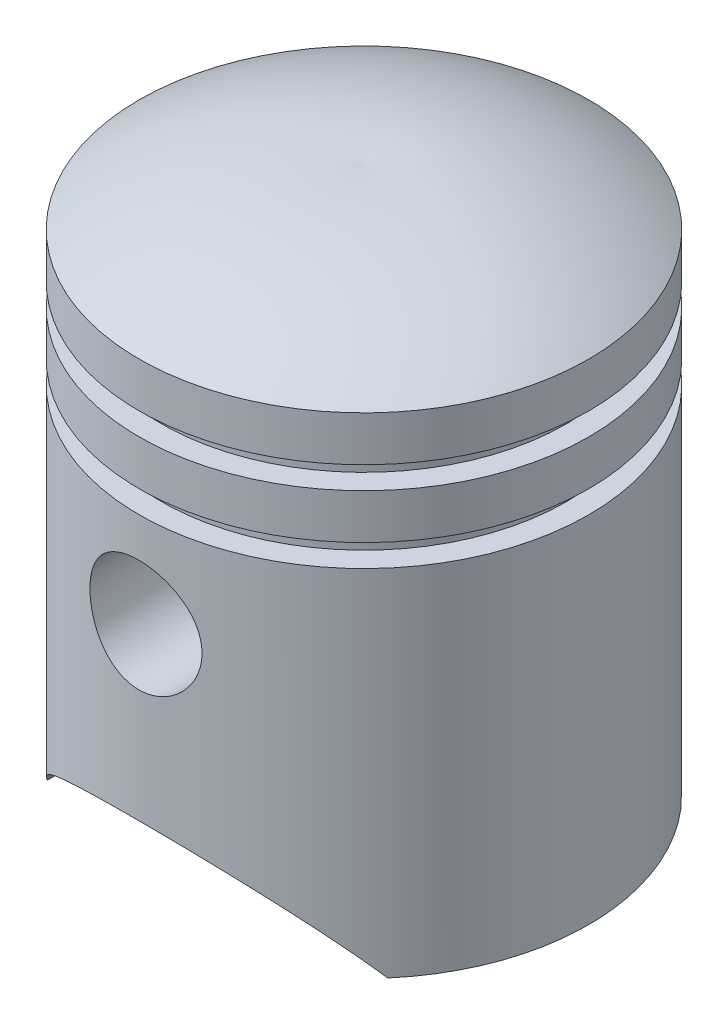
from build123d import *

# Parameters (mm, degrees)
SKETCH4_R                = 6.25
CUT_EXTRUDE3_DEPTH       = 32
BOSS_EXTRUDE7_REACH      = 84.511
BOSS_EXTRUDE7_END_RADIUS = 23
BOSS_EXTRUDE7_START      = 12
SKETCH9_R                = 7.25
SKETCH9_R_2              = 6.25


with BuildPart() as part:
    # Sketch1 → Revolve4 (revolve)
    with BuildSketch(Plane.XY, mode=Mode.PRIVATE) as revolve4_sk:
        with BuildLine():
            Line((25.048630769, 0), (25.048630769, 39.5))
            Line((25.048630769, 39.5), (22.548630769, 39.5))
            Line((22.548630769, 39.5), (22.548630769, 42))
            Line((22.548630769, 42), (25.048630769, 42))
            Line((25.048630769, 42), (25.048630769, 47))
            Line((25.048630769, 47), (22.548630769, 47))
            Line((22.548630769, 47), (22.548630769, 49.5))
            Line((22.548630769, 49.5), (25.048630769, 49.5))
            Line((25.048630769, 49.5), (25.048630769, 54.5))
            ThreePointArc((25.048630769, 54.5), (13.075515389, 59.751313502), (0.048630769, 60.86129661))
            Line((0.048630769, 60.86129661), (0.048630769, 58.85468145))
            ThreePointArc((0.048630769, 58.85468145), (11.983725985, 57.960231958), (23.048630769, 53.397949654))
            Line((23.048630769, 53.397949654), (23.048630769, 51.5))
            Line((23.048630769, 51.5), (20.548630769, 51.5))
            Line((20.548630769, 51.5), (20.548630769, 45))
            Line((20.548630769, 45), (23.048630769, 45))
            Line((23.048630769, 45), (23.048630769, 44))
            Line((23.048630769, 44), (20.548630769, 44))
            Line((20.548630769, 44), (20.548630769, 37.5))
            Line((20.548630769, 37.5), (23.048630769, 37.5))
            Line((23.048630769, 37.5), (23.048630769, 0))
            Line((23.048630769, 0), (25.048630769, 0))
        make_face()
    revolve(revolve4_sk.sketch.rotate(Axis((0.048630769, 60.86129661, 0), (0, -1, 0)), 180), axis=Axis((0.048630769, 60.86129661, 0), (0, -1, 0)))

    # Sketch4 → Cut-Extrude3 (cut, symmetric)
    with BuildSketch(Plane.XY):
        with Locations((0, 28.86129661)):
            Circle(SKETCH4_R)
        with BuildLine():
            Line((-19, 0), (19, 0))
            ThreePointArc((19, 0), (0, 10), (-19, 0))
        make_face()
    extrude(amount=CUT_EXTRUDE3_DEPTH, both=True, mode=Mode.SUBTRACT)

    # Boss-Extrude7: up to this cylinder (the profile starts inside it)
    boss_extrude7_end = Plane(origin=(0.048630769, 28.861297, 0), z_dir=(0, 1, 0)) * Cylinder(BOSS_EXTRUDE7_END_RADIUS, 216.022, mode=Mode.PRIVATE)
    # Sketch9 → Boss-Extrude7 (add, up to the surface)
    with BuildSketch(Plane.XY.offset(BOSS_EXTRUDE7_START), mode=Mode.PRIVATE) as boss_extrude7_sk1:
        with Locations(Location((0, 28.86129661, 0), (0, 0, 180))):
            Circle(SKETCH9_R)
        with Locations((0, 28.86129661)):
            Circle(SKETCH9_R_2, mode=Mode.SUBTRACT)
    boss_extrude7_tool1 = extrude(boss_extrude7_sk1.sketch, amount=BOSS_EXTRUDE7_REACH, mode=Mode.PRIVATE) & boss_extrude7_end
    boss_extrude7 = boss_extrude7_tool1.solids().sort_by_distance((7.044939, 28.861297, 12))[0]
    add(boss_extrude7)

    # Mirror2: Boss-Extrude7 across plane
    add(boss_extrude7.mirror(Plane.XY))


solid = part.part
